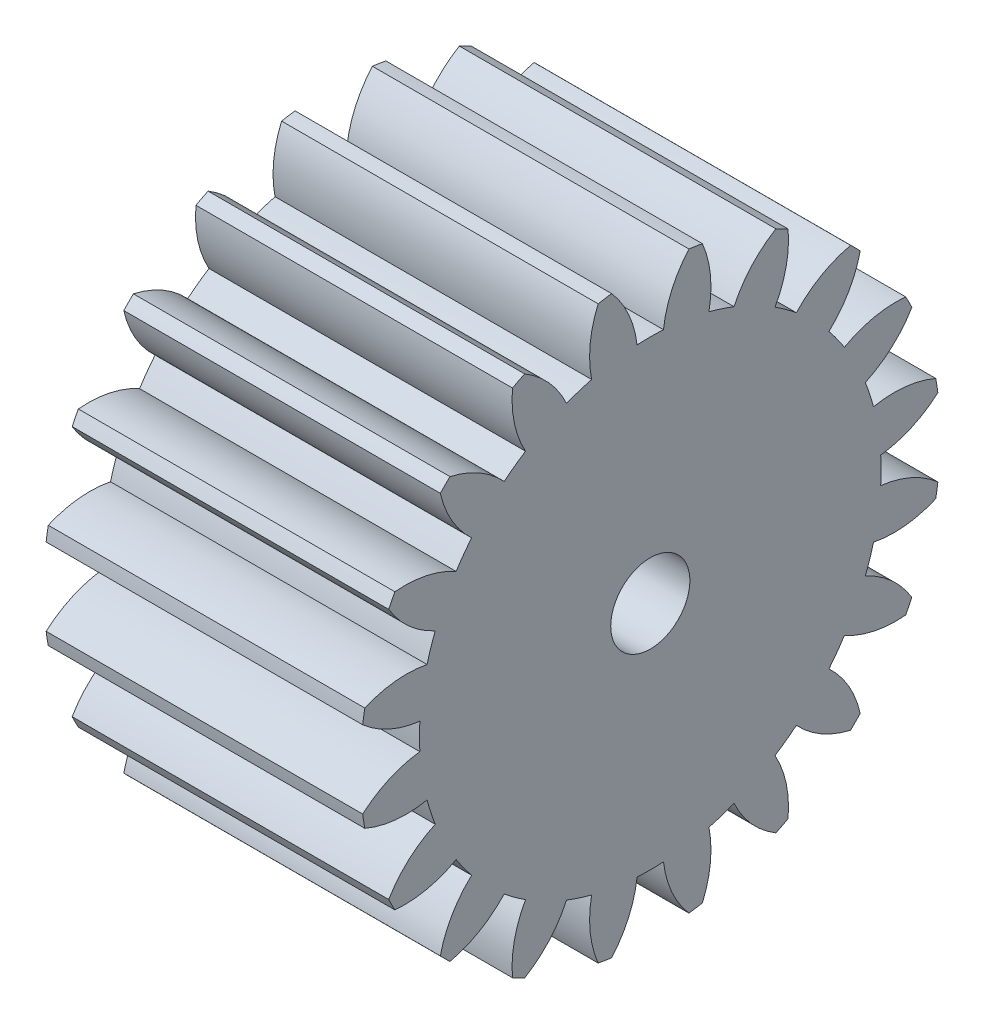
from build123d import *

# Parameters (mm, degrees)
BASPROSKE_W     = 12
BASPROSKE_H     = 11
TOOTHCUT_DEPTH  = 20.646882704
TEETHCUTS_COUNT = 20
TEETHCUTS_ANGLE = 342
BORSKE_R        = 1.5
BORE_DEPTH      = 50.0000508


with BuildPart() as part:
    # BasProSke → Base-Revolve (revolve)
    with BuildSketch(Plane(origin=(0, 0, 0), x_dir=(1, 0, 0), z_dir=(0, 1, 0)), mode=Mode.PRIVATE) as base_revolve_sk:
        with Locations((6, 5.5)):
            Rectangle(BASPROSKE_W, BASPROSKE_H)
    revolve(base_revolve_sk.sketch.rotate(Axis((-10, 0, 0), (1, 0, 0)), 180), axis=Axis((-10, 0, 0), (1, 0, 0)))

    # TooCutSke → ToothCut (cut, through all)
    with BuildSketch(Plane(origin=(0, 0, 0), x_dir=(0, 0, -1), z_dir=(1, 0, 0))):
        with BuildLine():
            ThreePointArc((0.499924007, 8.734705318), (0, 8.749), (-0.499924007, 8.734705318))
            ThreePointArc((-0.499924007, 8.734705318), (-0.824302243, 9.905497836), (-1.485192705, 10.924909509))
            ThreePointArc((-1.485192705, 10.924909509), (0, 11.0254), (1.485192705, 10.924909509))
            ThreePointArc((1.485192705, 10.924909509), (0.824302243, 9.905497836), (0.499924007, 8.734705318))
        make_face()
    toothcut = extrude(amount=TOOTHCUT_DEPTH, mode=Mode.SUBTRACT)

    # TeethCuts: ToothCut ×20 about axis
    teethcuts_axis = Axis((-10, 0, 0), (1, 0, 0))
    for i in range(1, TEETHCUTS_COUNT):
        add(toothcut.rotate(teethcuts_axis, i * TEETHCUTS_ANGLE / (TEETHCUTS_COUNT - 1)), mode=Mode.SUBTRACT)

    # BorSke → Bore (cut, symmetric)
    with BuildSketch(Plane(origin=(0, 0, 0), x_dir=(0, 0, -1), z_dir=(1, 0, 0))):
        with Locations(Location((0, 0, 0), (0, 0, 180))):
            Circle(BORSKE_R)
    extrude(amount=BORE_DEPTH, both=True, mode=Mode.SUBTRACT)


solid = part.part
